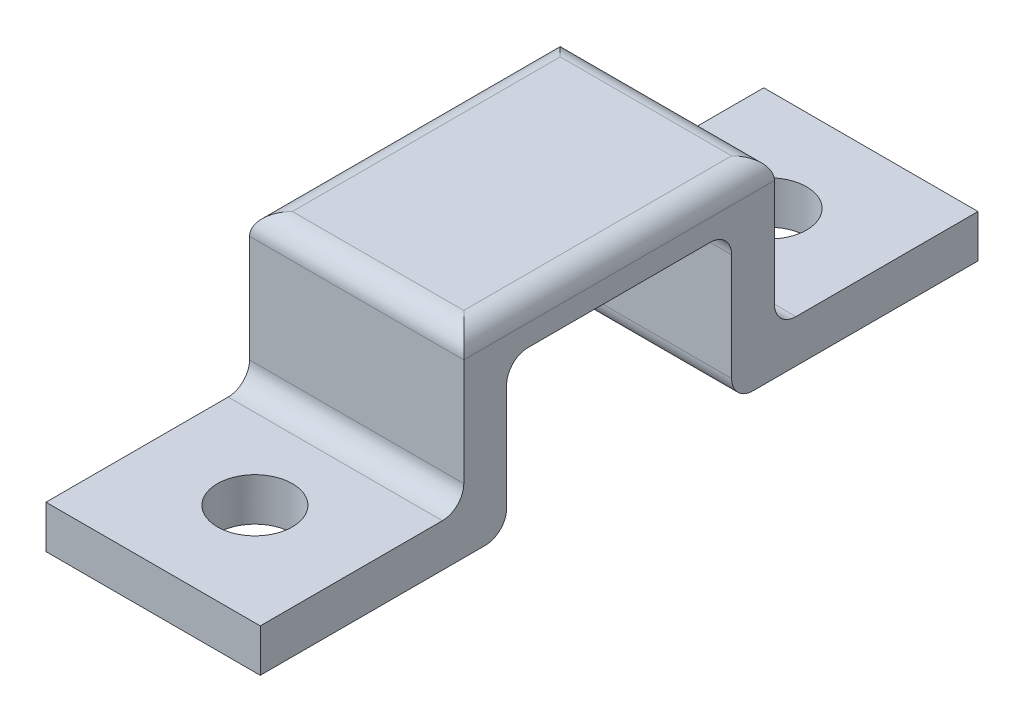
from build123d import *

# Parameters (mm, degrees)
BOSS_EXTRUDE1_DEPTH = 20
SKETCH2_R           = 3.5
CUT_EXTRUDE1_DEPTH  = 4
FILLET1_R           = 2


with BuildPart() as part:
    # Sketch1 → Boss-Extrude1 (new body)
    with BuildSketch(Plane(origin=(0, 0, 0), x_dir=(0, 0, -1), z_dir=(1, 0, 0))):
        Polygon((-10.5, 0), (10.5, 0), (10.5, -14), (33.5, -14), (33.5, -10), (14.5, -10), (14.5, 4), (-14.5, 4), (-14.5, -10), (-33.5, -10), (-33.5, -14), (-10.5, -14), align=None)
    extrude(amount=BOSS_EXTRUDE1_DEPTH)

    # Sketch2 → Cut-Extrude1 (cut)
    with BuildSketch(Plane(origin=(0, -10, 0), x_dir=(1, 0, 0), z_dir=(0, 1, 0))):
        with Locations(Location((10, 24, 0), (0, 0, 270))):
            Circle(SKETCH2_R)
    cut_extrude1 = extrude(amount=-CUT_EXTRUDE1_DEPTH, mode=Mode.SUBTRACT)

    # Mirror1: Cut-Extrude1 across plane
    add(cut_extrude1.mirror(Plane.XY), mode=Mode.SUBTRACT)

    # Fillet1
    fillet1_edges = [part.edges().sort_by_distance(p)[0] for p in [
        (0, 4, 0),
        (10, -14, 10.5),
        (10, -10, 14.5),
        (10, 4, 14.5),
        (10, 4, -14.5),
        (10, -10, -14.5),
        (10, -14, -10.5),
        (10, 0, -10.5),
        (10, 0, 10.5),
        (20, 4, 0),
    ]]
    fillet(fillet1_edges, radius=FILLET1_R)


solid = part.part
